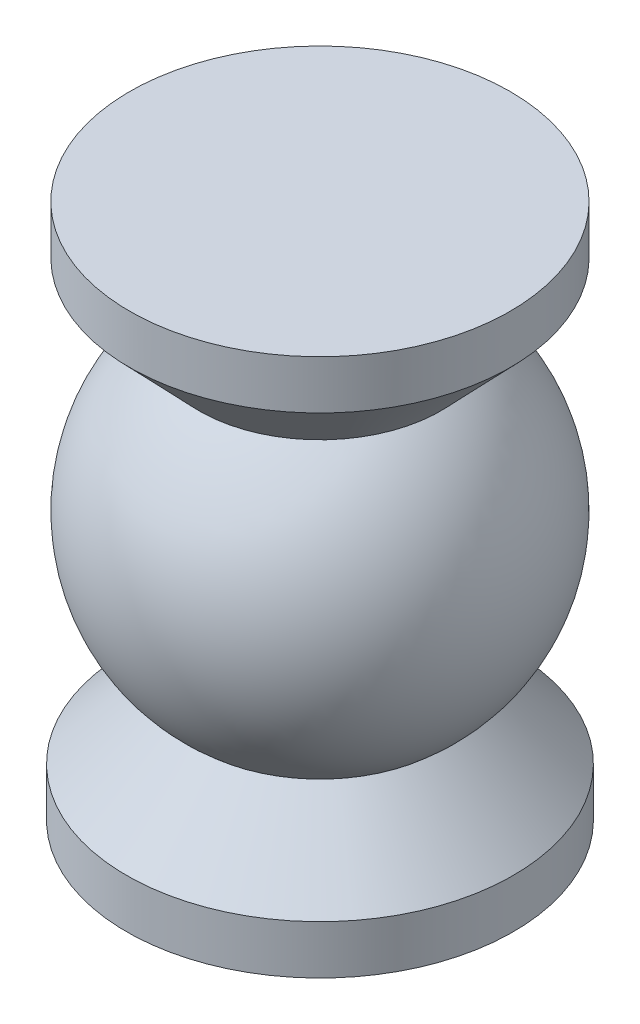
from build123d import *


with BuildPart() as part:
    # 草图1 → 旋转-薄壁3 (revolve)
    with BuildSketch(Plane.XY, mode=Mode.PRIVATE) as revolve_3_sk:
        with BuildLine():
            Line((-1, -33.401673559), (-25.4, -33.401673559))
            Line((-25.4, -33.401673559), (-25.4, -28.401673559))
            Line((-25.4, -28.401673559), (-15.4, -18.4))
            ThreePointArc((-15.4, -18.4), (-25, 0.8), (-15.4, 20))
            Line((-15.4, 20), (-25, 30.001673559))
            Line((-25, 30.001673559), (-25, 35.001673559))
            Line((-25, 35.001673559), (-1, 35.001673559))
            Line((-1, 35.001673559), (-1, 36.001673559))
            Line((-1, 36.001673559), (-26, 36.001673559))
            Line((-26, 36.001673559), (-26, 29.599411836))
            Line((-26, 29.599411836), (-16.885830121, 20.103896015))
            ThreePointArc((-16.885830121, 20.103896015), (-25.999997392, 0.811418377), (-16.903457024, -18.489376731))
            Line((-16.903457024, -18.489376731), (-26.4, -27.987509009))
            Line((-26.4, -27.987509009), (-26.4, -34.401673559))
            Line((-26.4, -34.401673559), (-1, -34.401673559))
            Line((-1, -34.401673559), (-1, -33.401673559))
        make_face()
    revolve(revolve_3_sk.sketch.rotate(Axis((-1, -999.2, 0), (0, 1, 0)), 270), axis=Axis((-1, -999.2, 0), (0, 1, 0)))


solid = part.part
